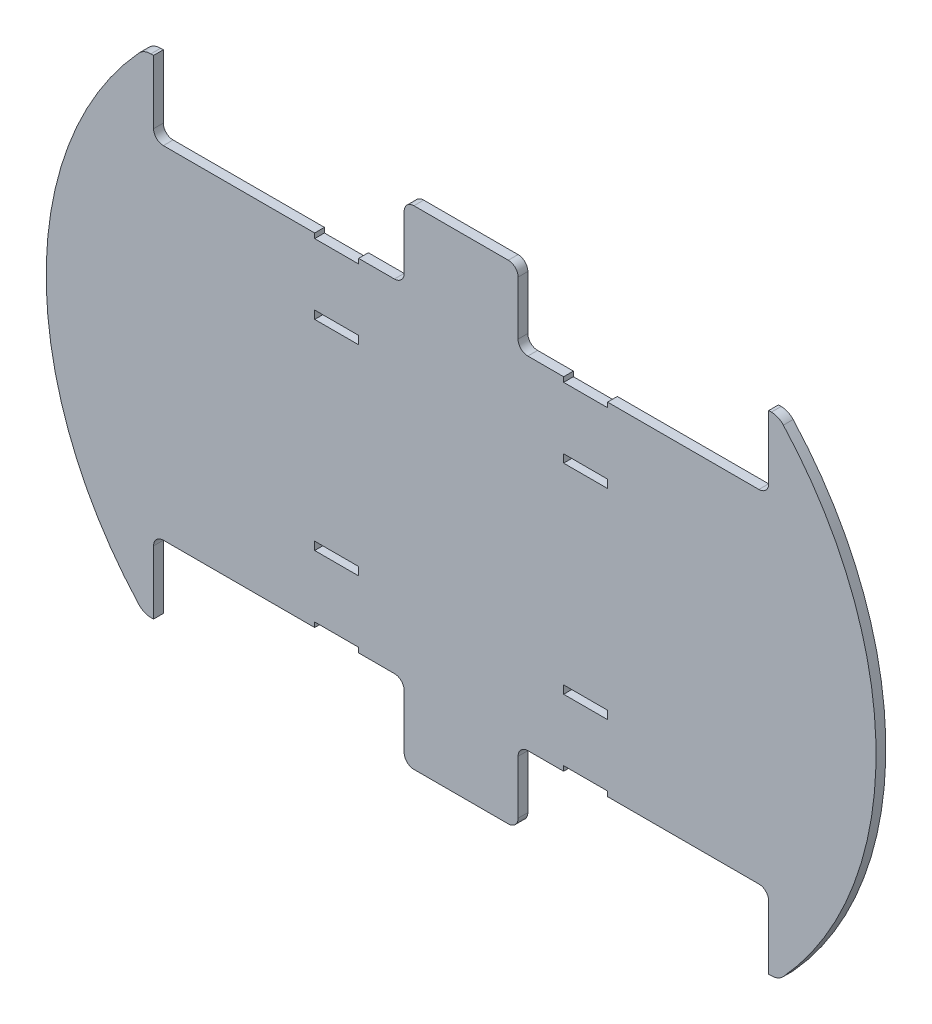
from build123d import *

# Parameters (mm, degrees)
IZIM1_W                     = 13.5
IZIM1_H                     = 2.5
Y_KSEKLIK_EKSTR_ZYON1_DEPTH = 3


with BuildPart() as part:
    # Çizim1 → Yükseklik-Ekstrüzyon1 (new body)
    with BuildSketch(Plane.XY):
        with BuildLine():
            Line((-17.5, 72), (-17.5, 55.5))
            ThreePointArc((-17.5, 55.5), (-18.378679656, 53.378679656), (-20.5, 52.5))
            Line((-20.5, 52.5), (-31.5, 52.5))
            Line((-31.5, 52.5), (-31.5, 51))
            Line((-31.5, 51), (-45, 51))
            Line((-45, 51), (-45, 52.5))
            Line((-45, 52.5), (-91.5, 52.5))
            ThreePointArc((-91.5, 52.5), (-93.621320344, 53.378679656), (-94.5, 55.5))
            Line((-94.5, 55.5), (-94.5, 75))
            Line((-94.5, 75), (-95.327166962, 75))
            ThreePointArc((-95.327166962, 75), (-97.34366518, 74.575339872), (-99.01763284, 73.373493976))
            ThreePointArc((-99.01763284, 73.373493976), (-127.5, 0), (-99.01763284, -73.373493976))
            ThreePointArc((-99.01763284, -73.373493976), (-97.34366518, -74.575339872), (-95.327166962, -75))
            Line((-95.327166962, -75), (-94.5, -75))
            Line((-94.5, -75), (-94.5, -55.5))
            ThreePointArc((-94.5, -55.5), (-93.621320344, -53.378679656), (-91.5, -52.5))
            Line((-91.5, -52.5), (-45, -52.5))
            Line((-45, -52.5), (-45, -51))
            Line((-45, -51), (-31.5, -51))
            Line((-31.5, -51), (-31.5, -52.5))
            Line((-31.5, -52.5), (-20.5, -52.5))
            ThreePointArc((-20.5, -52.5), (-18.378679656, -53.378679656), (-17.5, -55.5))
            Line((-17.5, -55.5), (-17.5, -72))
            ThreePointArc((-17.5, -72), (-16.621320344, -74.121320344), (-14.5, -75))
            Line((-14.5, -75), (14.5, -75))
            ThreePointArc((14.5, -75), (16.621320344, -74.121320344), (17.5, -72))
            Line((17.5, -72), (17.5, -55.5))
            ThreePointArc((17.5, -55.5), (18.378679656, -53.378679656), (20.5, -52.5))
            Line((20.5, -52.5), (31.5, -52.5))
            Line((31.5, -52.5), (31.5, -51))
            Line((31.5, -51), (45, -51))
            Line((45, -51), (45, -52.5))
            Line((45, -52.5), (91.5, -52.5))
            ThreePointArc((91.5, -52.5), (93.621320344, -53.378679656), (94.5, -55.5))
            Line((94.5, -55.5), (94.5, -75))
            Line((94.5, -75), (95.327166962, -75))
            ThreePointArc((95.327166962, -75), (97.34366518, -74.575339872), (99.01763284, -73.373493976))
            ThreePointArc((99.01763284, -73.373493976), (127.5, 0), (99.01763284, 73.373493976))
            ThreePointArc((99.01763284, 73.373493976), (97.34366518, 74.575339872), (95.327166962, 75))
            Line((95.327166962, 75), (94.5, 75))
            Line((94.5, 75), (94.5, 55.5))
            ThreePointArc((94.5, 55.5), (93.621320344, 53.378679656), (91.5, 52.5))
            Line((91.5, 52.5), (45, 52.5))
            Line((45, 52.5), (45, 51))
            Line((45, 51), (31.5, 51))
            Line((31.5, 51), (31.5, 52.5))
            Line((31.5, 52.5), (20.5, 52.5))
            ThreePointArc((20.5, 52.5), (18.378679656, 53.378679656), (17.5, 55.5))
            Line((17.5, 55.5), (17.5, 72))
            ThreePointArc((17.5, 72), (16.621320344, 74.121320344), (14.5, 75))
            Line((14.5, 75), (-14.5, 75))
            ThreePointArc((-14.5, 75), (-16.621320344, 74.121320344), (-17.5, 72))
        make_face()
        with Locations((38.25, 30.75)):
            Rectangle(IZIM1_W, IZIM1_H, mode=Mode.SUBTRACT)
        with Locations((-38.25, -30.75)):
            Rectangle(IZIM1_W, IZIM1_H, mode=Mode.SUBTRACT)
        with Locations((-38.25, 30.75)):
            Rectangle(IZIM1_W, IZIM1_H, mode=Mode.SUBTRACT)
        with Locations((38.25, -30.75)):
            Rectangle(IZIM1_W, IZIM1_H, mode=Mode.SUBTRACT)
    extrude(amount=Y_KSEKLIK_EKSTR_ZYON1_DEPTH)


solid = part.part
